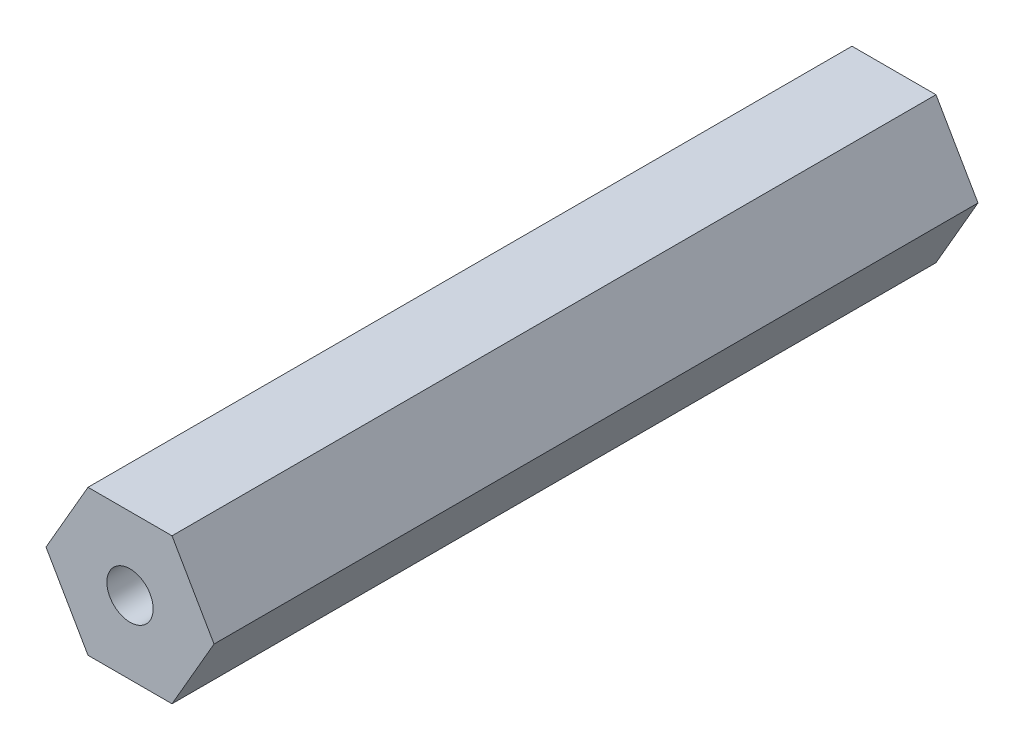
from build123d import *

# Parameters (mm, degrees)
BOSS_EXTRUDE1_DEPTH                  = 33.3375
F_10_32_TAPPED_HOLE1_D               = 4.0386
F_10_32_TAPPED_HOLE1_DEPTH           = 11.938
F_10_32_TAPPED_HOLE1_TIP             = 1.213317848
F_10_32_TAPPED_HOLE1_ON_FACE_2_D     = 4.0386
F_10_32_TAPPED_HOLE1_ON_FACE_2_DEPTH = 11.938
F_10_32_TAPPED_HOLE1_ON_FACE_2_TIP   = 1.213317848


with BuildPart() as part:
    # Sketch1 → Boss-Extrude1 (new, symmetric)
    with BuildSketch(Plane.XY):
        Polygon((-7.332348419, 0), (-3.666174209, -6.35), (3.666174209, -6.35), (7.332348419, 0), (3.666174209, 6.35), (-3.666174209, 6.35), align=None)
    extrude(amount=BOSS_EXTRUDE1_DEPTH, both=True)

    # #10-32 Tapped Hole1
    with Locations(Plane.XY.offset(33.3375)):
        with Locations((0, 0)):
            Hole(F_10_32_TAPPED_HOLE1_D / 2, depth=F_10_32_TAPPED_HOLE1_DEPTH)
            with Locations((0, 0, -(F_10_32_TAPPED_HOLE1_DEPTH + F_10_32_TAPPED_HOLE1_TIP / 2))):  # 118° drill point
                Cone(0, F_10_32_TAPPED_HOLE1_D / 2, F_10_32_TAPPED_HOLE1_TIP, mode=Mode.SUBTRACT)

    # #10-32 Tapped Hole1 on face 2
    with Locations(Plane(origin=(0, 0, -33.3375), x_dir=(-1, 0, 0), z_dir=(0, 0, -1))):
        with Locations((0, 0)):
            Hole(F_10_32_TAPPED_HOLE1_ON_FACE_2_D / 2, depth=F_10_32_TAPPED_HOLE1_ON_FACE_2_DEPTH)
            with Locations((0, 0, -(F_10_32_TAPPED_HOLE1_ON_FACE_2_DEPTH + F_10_32_TAPPED_HOLE1_ON_FACE_2_TIP / 2))):  # 118° drill point
                Cone(0, F_10_32_TAPPED_HOLE1_ON_FACE_2_D / 2, F_10_32_TAPPED_HOLE1_ON_FACE_2_TIP, mode=Mode.SUBTRACT)


solid = part.part
